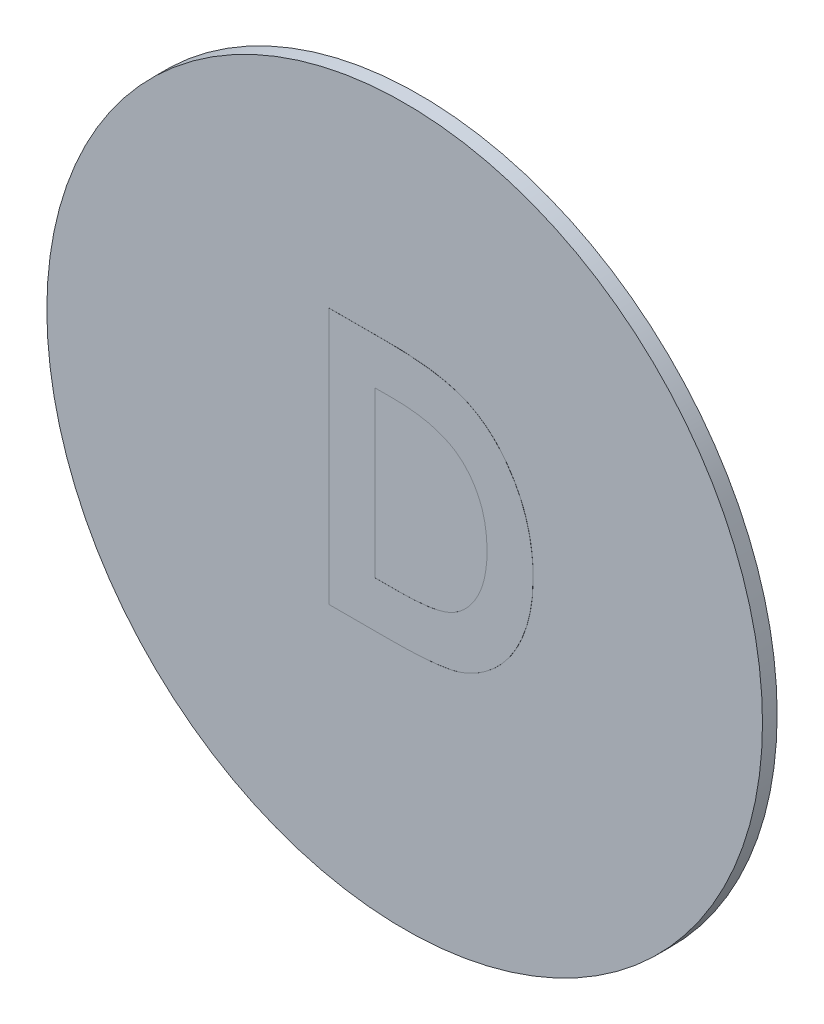
from build123d import *

# Parameters (mm, degrees)
SKETCH1_R           = 4.88
BOSS_EXTRUDE1_DEPTH = 0.2
BOSS_EXTRUDE2_DEPTH = 0.001


with BuildPart() as part:
    # Sketch1 → Boss-Extrude1 (new body)
    with BuildSketch(Plane.XY):
        with Locations((-23.609402801, 8.006667037)):
            Circle(SKETCH1_R)
    extrude(amount=BOSS_EXTRUDE1_DEPTH)

    # Sketch2 → Boss-Extrude2 (add)
    with BuildSketch(Plane.XY.offset(0.2)):
        with BuildLine():
            Line((-24.638921092, 9.949558898), (-23.847354586, 9.949558898))
            add(Edge.make_bspline(
                [(-23.847354586, 9.949558898), (-23.785642872, 9.949127512), (-23.666353431, 9.948293638), (-23.493526632, 9.938897884), (-23.3328197, 9.92444788), (-23.184129043, 9.904569281), (-23.047759499, 9.878264451), (-22.923886914, 9.845270197), (-22.812095543, 9.80718382), (-22.711159616, 9.762367469), (-22.619014823, 9.710116054), (-22.531520401, 9.651912174), (-22.448848143, 9.585623648), (-22.369837876, 9.512529316), (-22.295509243, 9.431291939), (-22.224624407, 9.343257102), (-22.158918949, 9.247148179), (-22.096406736, 9.145269558), (-22.039872757, 9.037189487), (-21.990561709, 8.923827923), (-21.949253545, 8.805914387), (-21.915688522, 8.683323216), (-21.888933325, 8.556461375), (-21.870213253, 8.425072869), (-21.858640318, 8.28927934), (-21.857466341, 8.197245399), (-21.85686981, 8.150480373)],
                knots=[0, 0, 0, 0, 1.44355588, 2.790409838, 4.047694926, 5.217575253, 6.298404546, 7.294384826, 8.214239204, 9.058592145, 9.873746385, 10.689560431, 11.514393297, 12.350027578, 13.205127629, 14.088021785, 14.991911688, 15.926770944, 16.882954281, 17.842803888, 18.816321264, 19.80318086, 20.814351908, 21.847355356, 22.906180909, 24, 24, 24, 24], degree=3))
            add(Edge.make_bspline(
                [(-21.85686981, 8.150480373), (-21.85843185, 8.084491877), (-21.861506817, 7.954589661), (-21.88740862, 7.763959656), (-21.929300607, 7.581221782), (-21.988204545, 7.407805488), (-22.06122966, 7.245255069), (-22.148466338, 7.096437035), (-22.248635484, 6.962150166), (-22.360570124, 6.8430631), (-22.481768076, 6.740706152), (-22.607717189, 6.653044917), (-22.739644436, 6.583916719), (-22.855890777, 6.540079104), (-22.956690858, 6.5128159), (-23.045192238, 6.496703084), (-23.145720776, 6.481926659), (-23.259213813, 6.470507757), (-23.38517348, 6.460324902), (-23.524101853, 6.454791935), (-23.675549121, 6.45019486), (-23.780743569, 6.44977644), (-23.835435515, 6.449558898)],
                knots=[0, 0, 0, 0, 1.315458931, 2.589557908, 3.828601765, 5.048913369, 6.235739168, 7.376350998, 8.481830359, 9.569842114, 10.627874879, 11.640079404, 12.624025415, 13.590060155, 14.111227486, 14.704434459, 15.382649715, 16.137166398, 16.978595427, 17.902333227, 18.909396075, 20, 20, 20, 20], degree=3))
            Line((-23.835435515, 6.449558898), (-24.638921092, 6.449558898))
            Line((-24.638921092, 6.449558898), (-24.638921092, 9.949558898))
        make_face()
        with BuildLine():
            Line((-24.010715964, 9.32135377), (-24.010715964, 7.077764027))
            Line((-24.010715964, 7.077764027), (-23.682590964, 7.077764027))
            add(Edge.make_bspline(
                [(-23.682590964, 7.077764027), (-23.643549128, 7.077835567), (-23.568458681, 7.077973164), (-23.460045072, 7.084527018), (-23.359789974, 7.09110528), (-23.267969364, 7.103591041), (-23.183915, 7.1174993), (-23.10878157, 7.136854547), (-23.041020248, 7.157185594), (-22.981458724, 7.183069538), (-22.92690522, 7.212203639), (-22.876394908, 7.246337615), (-22.827638314, 7.284242109), (-22.781546984, 7.327031945), (-22.737946472, 7.374140505), (-22.697094746, 7.425810519), (-22.658446545, 7.48188434), (-22.622993894, 7.542658445), (-22.590597072, 7.607491044), (-22.56185746, 7.675754141), (-22.538028081, 7.748016219), (-22.518222561, 7.823600818), (-22.50406927, 7.903165988), (-22.492360122, 7.986122401), (-22.486323715, 8.072798724), (-22.485495256, 8.131776191), (-22.485074938, 8.161698321)],
                knots=[0, 0, 0, 0, 1.50275155, 2.890291501, 4.180787663, 5.369391935, 6.45668281, 7.458360028, 8.354766181, 9.177074746, 9.954075863, 10.732690366, 11.5210699, 12.329727389, 13.151100085, 13.990027547, 14.863562427, 15.770965086, 16.696477834, 17.652329173, 18.619756807, 19.62365428, 20.657822005, 21.729286259, 22.847956731, 24, 24, 24, 24], degree=3))
            add(Edge.make_bspline(
                [(-22.485074938, 8.161698321), (-22.485912068, 8.207551158), (-22.487544407, 8.296960637), (-22.503286326, 8.427187495), (-22.528911167, 8.54981559), (-22.565475347, 8.664389817), (-22.611565628, 8.77123219), (-22.66925836, 8.869437527), (-22.736070668, 8.960655544), (-22.788904019, 9.014166959), (-22.815303304, 9.040905052)],
                knots=[0, 0, 0, 0, 1.13821349, 2.219428113, 3.251817212, 4.244760574, 5.201143372, 6.134805572, 7.068016741, 8, 8, 8, 8], degree=3))
            add(Edge.make_bspline(
                [(-22.815303304, 9.040905052), (-22.841335498, 9.063689523), (-22.894503307, 9.110224223), (-22.987848507, 9.165984695), (-23.090710084, 9.214975736), (-23.205441201, 9.253820167), (-23.330933033, 9.284539999), (-23.467933013, 9.305726716), (-23.615707474, 9.319341076), (-23.718082178, 9.320668499), (-23.77093231, 9.32135377)],
                knots=[0, 0, 0, 0, 0.813307809, 1.661089106, 2.549956539, 3.493439533, 4.508053171, 5.589449661, 6.755572447, 8, 8, 8, 8], degree=3))
            Line((-23.77093231, 9.32135377), (-24.010715964, 9.32135377))
        make_face(mode=Mode.SUBTRACT)
    extrude(amount=BOSS_EXTRUDE2_DEPTH)


solid = part.part
